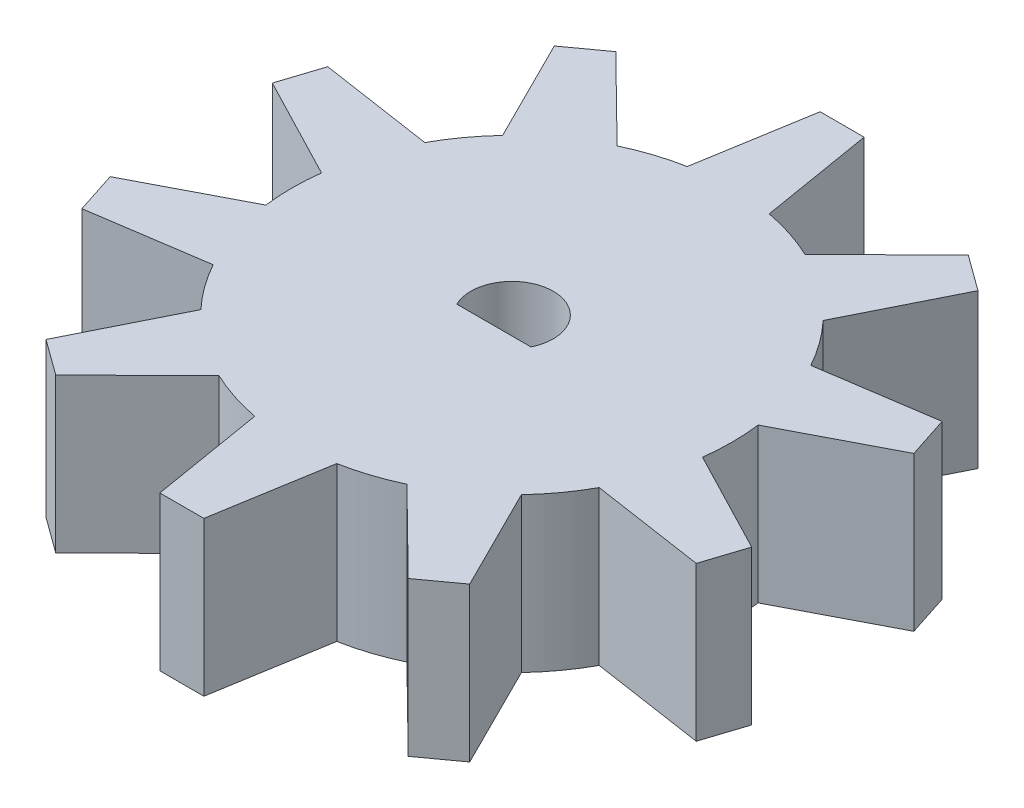
from build123d import *

# Parameters (mm, degrees)
BOSS_EXTRUDE2_DEPTH = 7
CUT_EXTRUDE1_DEPTH  = 7


with BuildPart() as part:
    # Sketch1 → Boss-Extrude2 (new body)
    with BuildSketch(Plane(origin=(0, 0, 0), x_dir=(1, 0, 0), z_dir=(0, 1, 0))):
        with BuildLine():
            Line((-2, 9), (-1.862495894, 9.825024633))
            ThreePointArc((-1.862495894, 9.825024633), (-3.090169944, 9.510565163), (-4.268213752, 9.043359518))
            Line((-4.268213752, 9.043359518), (-3.672033282, 8.456723454))
            Line((-3.672033282, 8.456723454), (-6.908101259, 6.105582445))
            Line((-6.908101259, 6.105582445), (-7.281795413, 6.853864279))
            ThreePointArc((-7.281795413, 6.853864279), (-8.090169944, 5.877852523), (-8.768610817, 4.807438439))
            Line((-8.768610817, 4.807438439), (-7.941474658, 4.683265982))
            Line((-7.941474658, 4.683265982), (-9.177542635, 0.879039917))
            Line((-9.177542635, 0.879039917), (-9.919696584, 1.264760725))
            ThreePointArc((-9.919696584, 1.264760725), (-10, 0), (-9.919696584, -1.264760725))
            Line((-9.919696584, -1.264760725), (-9.177542635, -0.879039917))
            Line((-9.177542635, -0.879039917), (-7.941474658, -4.683265982))
            Line((-7.941474658, -4.683265982), (-8.768610817, -4.807438439))
            ThreePointArc((-8.768610817, -4.807438439), (-8.090169944, -5.877852523), (-7.281795413, -6.853864279))
            Line((-7.281795413, -6.853864279), (-6.908101259, -6.105582445))
            Line((-6.908101259, -6.105582445), (-3.672033282, -8.456723454))
            Line((-3.672033282, -8.456723454), (-4.268213752, -9.043359518))
            ThreePointArc((-4.268213752, -9.043359518), (-3.090169944, -9.510565163), (-1.862495894, -9.825024633))
            Line((-1.862495894, -9.825024633), (-2, -9))
            Line((-2, -9), (2, -9))
            Line((2, -9), (1.862495894, -9.825024633))
            ThreePointArc((1.862495894, -9.825024633), (3.090169944, -9.510565163), (4.268213752, -9.043359518))
            Line((4.268213752, -9.043359518), (3.672033282, -8.456723454))
            Line((3.672033282, -8.456723454), (6.908101259, -6.105582445))
            Line((6.908101259, -6.105582445), (7.281795413, -6.853864279))
            ThreePointArc((7.281795413, -6.853864279), (8.090169944, -5.877852523), (8.768610817, -4.807438439))
            Line((8.768610817, -4.807438439), (7.941474658, -4.683265982))
            Line((7.941474658, -4.683265982), (9.177542635, -0.879039917))
            Line((9.177542635, -0.879039917), (9.919696584, -1.264760725))
            ThreePointArc((9.919696584, -1.264760725), (9.979903953, -0.633653756), (10, 0))
            ThreePointArc((10, 0), (9.979903953, 0.633653756), (9.919696584, 1.264760725))
            Line((9.919696584, 1.264760725), (9.177542635, 0.879039917))
            Line((9.177542635, 0.879039917), (7.941474658, 4.683265982))
            Line((7.941474658, 4.683265982), (8.768610817, 4.807438439))
            ThreePointArc((8.768610817, 4.807438439), (8.090169944, 5.877852523), (7.281795413, 6.853864279))
            Line((7.281795413, 6.853864279), (6.908101259, 6.105582445))
            Line((6.908101259, 6.105582445), (3.672033282, 8.456723454))
            Line((3.672033282, 8.456723454), (4.268213752, 9.043359518))
            ThreePointArc((4.268213752, 9.043359518), (3.090169944, 9.510565163), (1.862495894, 9.825024633))
            Line((1.862495894, 9.825024633), (2, 9))
            Line((2, 9), (-2, 9))
        make_face()
        with BuildLine():
            ThreePointArc((-8.768610817, -4.807438439), (-9.510565163, -3.090169944), (-9.919696584, -1.264760725))
            Line((-9.919696584, -1.264760725), (-14.574864739, -3.684198399))
            Line((-14.574864739, -3.684198399), (-13.95683075, -5.586311432))
            Line((-13.95683075, -5.586311432), (-8.768610817, -4.807438439))
        make_face()
        with BuildLine():
            ThreePointArc((-4.268213752, -9.043359518), (-5.877852523, -8.090169944), (-7.281795413, -6.853864279))
            Line((-7.281795413, -6.853864279), (-9.625795779, -11.547469663))
            Line((-9.625795779, -11.547469663), (-8.00776179, -12.723040168))
            Line((-8.00776179, -12.723040168), (-4.268213752, -9.043359518))
        make_face()
        with BuildLine():
            ThreePointArc((1.862495894, -9.825024633), (0, -10), (-1.862495894, -9.825024633))
            Line((-1.862495894, -9.825024633), (-1, -15))
            Line((-1, -15), (1, -15))
            Line((1, -15), (1.862495894, -9.825024633))
        make_face()
        with BuildLine():
            Line((9.625795779, -11.547469663), (7.281795413, -6.853864279))
            ThreePointArc((7.281795413, -6.853864279), (5.877852523, -8.090169944), (4.268213752, -9.043359518))
            Line((4.268213752, -9.043359518), (8.00776179, -12.723040168))
            Line((8.00776179, -12.723040168), (9.625795779, -11.547469663))
        make_face()
        with BuildLine():
            Line((14.574864739, -3.684198399), (9.919696584, -1.264760725))
            ThreePointArc((9.919696584, -1.264760725), (9.510565163, -3.090169944), (8.768610817, -4.807438439))
            Line((8.768610817, -4.807438439), (13.95683075, -5.586311432))
            Line((13.95683075, -5.586311432), (14.574864739, -3.684198399))
        make_face()
        with BuildLine():
            Line((13.95683075, 5.586311432), (8.768610817, 4.807438439))
            ThreePointArc((8.768610817, 4.807438439), (9.510565163, 3.090169944), (9.919696584, 1.264760725))
            Line((9.919696584, 1.264760725), (14.574864739, 3.684198399))
            Line((14.574864739, 3.684198399), (13.95683075, 5.586311432))
        make_face()
        with BuildLine():
            Line((8.00776179, 12.723040168), (4.268213752, 9.043359518))
            ThreePointArc((4.268213752, 9.043359518), (5.877852523, 8.090169944), (7.281795413, 6.853864279))
            Line((7.281795413, 6.853864279), (9.625795779, 11.547469663))
            Line((9.625795779, 11.547469663), (8.00776179, 12.723040168))
        make_face()
        with BuildLine():
            Line((1, 15), (-1, 15))
            Line((-1, 15), (-1.862495894, 9.825024633))
            ThreePointArc((-1.862495894, 9.825024633), (0, 10), (1.862495894, 9.825024633))
            Line((1.862495894, 9.825024633), (1, 15))
        make_face()
        with BuildLine():
            ThreePointArc((-7.281795413, 6.853864279), (-5.877852523, 8.090169944), (-4.268213752, 9.043359518))
            Line((-4.268213752, 9.043359518), (-8.00776179, 12.723040168))
            Line((-8.00776179, 12.723040168), (-9.625795779, 11.547469663))
            Line((-9.625795779, 11.547469663), (-7.281795413, 6.853864279))
        make_face()
        with BuildLine():
            ThreePointArc((-9.919696584, 1.264760725), (-9.510565163, 3.090169944), (-8.768610817, 4.807438439))
            Line((-8.768610817, 4.807438439), (-13.95683075, 5.586311432))
            Line((-13.95683075, 5.586311432), (-14.574864739, 3.684198399))
            Line((-14.574864739, 3.684198399), (-9.919696584, 1.264760725))
        make_face()
        with BuildLine():
            Line((-7.941474658, 4.683265982), (-8.768610817, 4.807438439))
            ThreePointArc((-8.768610817, 4.807438439), (-9.510565163, 3.090169944), (-9.919696584, 1.264760725))
            Line((-9.919696584, 1.264760725), (-9.177542635, 0.879039917))
            Line((-9.177542635, 0.879039917), (-7.941474658, 4.683265982))
        make_face()
        with BuildLine():
            Line((-2, -9), (-1.862495894, -9.825024633))
            ThreePointArc((-1.862495894, -9.825024633), (0, -10), (1.862495894, -9.825024633))
            Line((1.862495894, -9.825024633), (2, -9))
            Line((2, -9), (-2, -9))
        make_face()
        with BuildLine():
            ThreePointArc((4.268213752, -9.043359518), (5.877852523, -8.090169944), (7.281795413, -6.853864279))
            Line((7.281795413, -6.853864279), (6.908101259, -6.105582445))
            Line((6.908101259, -6.105582445), (3.672033282, -8.456723454))
            Line((3.672033282, -8.456723454), (4.268213752, -9.043359518))
        make_face()
        with BuildLine():
            Line((-6.908101259, -6.105582445), (-7.281795413, -6.853864279))
            ThreePointArc((-7.281795413, -6.853864279), (-5.877852523, -8.090169944), (-4.268213752, -9.043359518))
            Line((-4.268213752, -9.043359518), (-3.672033282, -8.456723454))
            Line((-3.672033282, -8.456723454), (-6.908101259, -6.105582445))
        make_face()
        with BuildLine():
            Line((-9.177542635, -0.879039917), (-9.919696584, -1.264760725))
            ThreePointArc((-9.919696584, -1.264760725), (-9.510565163, -3.090169944), (-8.768610817, -4.807438439))
            Line((-8.768610817, -4.807438439), (-7.941474658, -4.683265982))
            Line((-7.941474658, -4.683265982), (-9.177542635, -0.879039917))
        make_face()
        with BuildLine():
            Line((-3.672033282, 8.456723454), (-4.268213752, 9.043359518))
            ThreePointArc((-4.268213752, 9.043359518), (-5.877852523, 8.090169944), (-7.281795413, 6.853864279))
            Line((-7.281795413, 6.853864279), (-6.908101259, 6.105582445))
            Line((-6.908101259, 6.105582445), (-3.672033282, 8.456723454))
        make_face()
        with BuildLine():
            ThreePointArc((1.862495894, 9.825024633), (0, 10), (-1.862495894, 9.825024633))
            Line((-1.862495894, 9.825024633), (-2, 9))
            Line((-2, 9), (2, 9))
            Line((2, 9), (1.862495894, 9.825024633))
        make_face()
        with BuildLine():
            ThreePointArc((7.281795413, 6.853864279), (5.877852523, 8.090169944), (4.268213752, 9.043359518))
            Line((4.268213752, 9.043359518), (3.672033282, 8.456723454))
            Line((3.672033282, 8.456723454), (6.908101259, 6.105582445))
            Line((6.908101259, 6.105582445), (7.281795413, 6.853864279))
        make_face()
        with BuildLine():
            ThreePointArc((9.919696584, 1.264760725), (9.510565163, 3.090169944), (8.768610817, 4.807438439))
            Line((8.768610817, 4.807438439), (7.941474658, 4.683265982))
            Line((7.941474658, 4.683265982), (9.177542635, 0.879039917))
            Line((9.177542635, 0.879039917), (9.919696584, 1.264760725))
        make_face()
        with BuildLine():
            ThreePointArc((8.768610817, -4.807438439), (9.510565163, -3.090169944), (9.919696584, -1.264760725))
            Line((9.919696584, -1.264760725), (9.177542635, -0.879039917))
            Line((9.177542635, -0.879039917), (7.941474658, -4.683265982))
            Line((7.941474658, -4.683265982), (8.768610817, -4.807438439))
        make_face()
    extrude(amount=BOSS_EXTRUDE2_DEPTH)

    # Sketch3 → Cut-Extrude1 (cut)
    with BuildSketch(Plane.XZ):
        with BuildLine():
            Line((-1.683745824, 0.825), (1.683745824, 0.825))
            ThreePointArc((1.683745824, 0.825), (0, -1.875), (-1.683745824, 0.825))
        make_face()
    extrude(amount=-CUT_EXTRUDE1_DEPTH, mode=Mode.SUBTRACT)


solid = part.part
